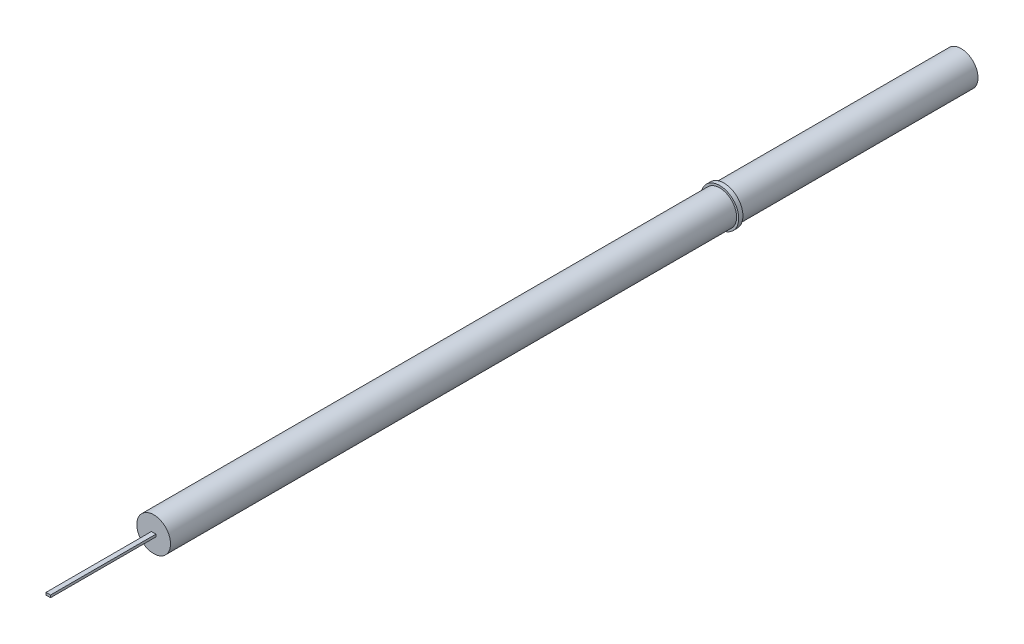
from build123d import *

# Parameters (mm, degrees)
SKETCH4_R           = 0.8
BOSS_EXTRUDE2_DEPTH = 38.3
SKETCH6_R           = 0.9
BOSS_EXTRUDE3_DEPTH = 0.2
SKETCH7_R           = 0.75
CUT_EXTRUDE1_DEPTH  = 38.25
SKETCH8_W           = 0.215319984
SKETCH8_H           = 0.113992932
BOSS_EXTRUDE4_DEPTH = 5


with BuildPart() as part:
    # Sketch4 → Boss-Extrude2 (new body)
    with BuildSketch(Plane.XY):
        Circle(SKETCH4_R)
    extrude(amount=BOSS_EXTRUDE2_DEPTH)

    # Sketch6 → Boss-Extrude3 (add)
    with BuildSketch(Plane(origin=(0, 0, 11.45), x_dir=(-1, 0, 0), z_dir=(0, 0, -1))):
        Circle(SKETCH6_R)
    extrude(amount=BOSS_EXTRUDE3_DEPTH)

    # Sketch7 → Cut-Extrude1 (cut)
    with BuildSketch(Plane(origin=(0, 0, 0), x_dir=(-1, 0, 0), z_dir=(0, 0, -1))):
        Circle(SKETCH7_R)
    extrude(amount=-CUT_EXTRUDE1_DEPTH, mode=Mode.SUBTRACT)

    # Sketch8 → Boss-Extrude4 (add)
    with BuildSketch(Plane.XY.offset(38.3)):
        Rectangle(SKETCH8_W, SKETCH8_H)
    extrude(amount=BOSS_EXTRUDE4_DEPTH)


solid = part.part
